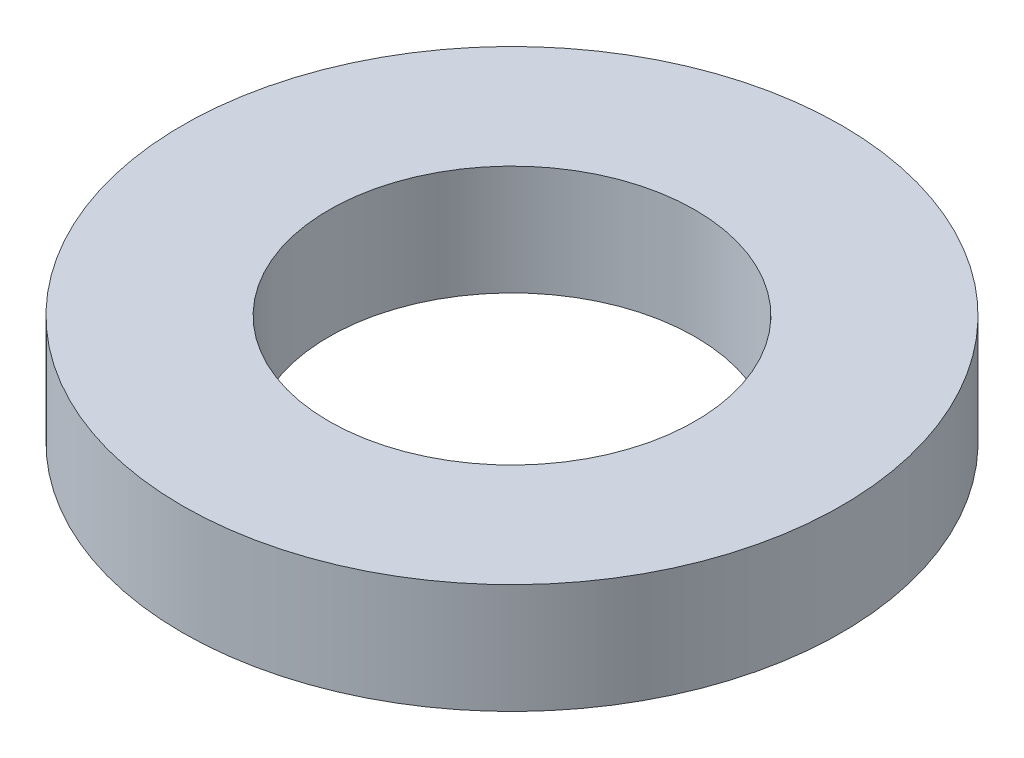
from build123d import *

# Parameters (mm, degrees)
SKETCH_1_R      = 9
SKETCH_1_R_2    = 5
EXTRUDE_1_DEPTH = 3


with BuildPart() as part:
    # 草图1 → 凸台-拉伸1 (new body)
    with BuildSketch(Plane(origin=(0, 0, 0), x_dir=(1, 0, 0), z_dir=(0, 1, 0))):
        with Locations(Location((0, 0, 0), (0, 0, 270))):
            Circle(SKETCH_1_R)
        with Locations(Location((0, 0, 0), (0, 0, 270))):
            Circle(SKETCH_1_R_2, mode=Mode.SUBTRACT)
    extrude(amount=EXTRUDE_1_DEPTH)


solid = part.part
